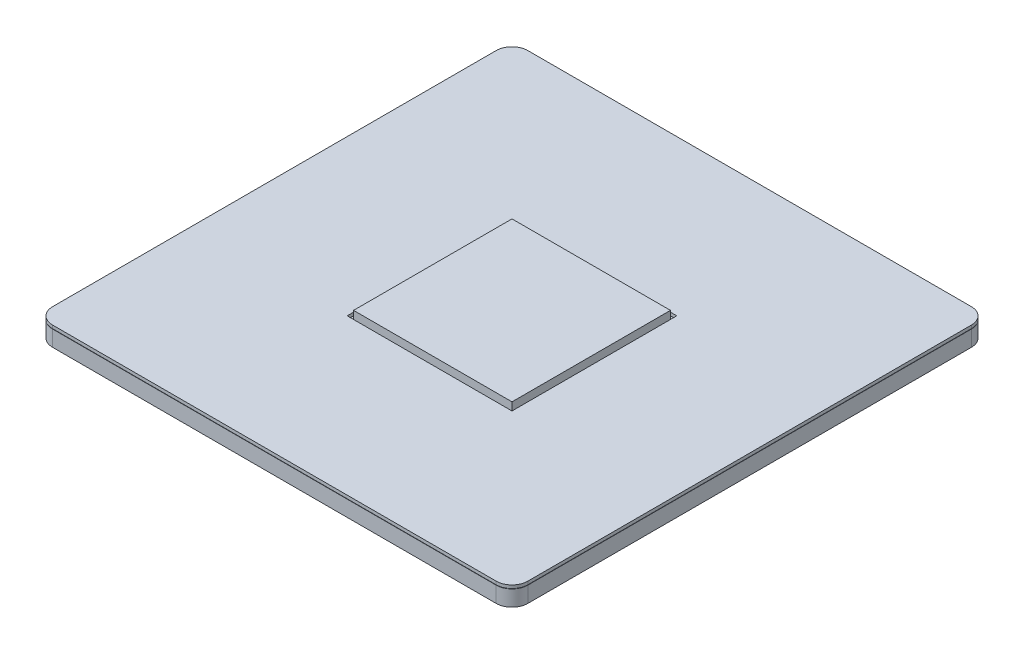
from build123d import *

# Parameters (mm, degrees)
SKETCH_1_W      = 15
SKETCH_1_H      = 15
EXTRUDE_1_DEPTH = 0.5
FILLET_1_R      = 0.5
EXTRUDE_START   = 0.1
SKETCH_2_W      = 5.2
SKETCH_2_H      = 5.2
EXTRUDE_2_DEPTH = 0.1
SKETCH_3_W      = 5
SKETCH_3_H      = 5
EXTRUDE_3_DEPTH = 0.25


with BuildPart() as part:
    # 草图1 → 凸台-拉伸1 (new body)
    with BuildSketch(Plane(origin=(0, 0, 0), x_dir=(1, 0, 0), z_dir=(0, 1, 0))):
        Rectangle(SKETCH_1_W, SKETCH_1_H)
    extrude(amount=EXTRUDE_1_DEPTH)

    # 圆角1
    fillet_1_edges = [part.edges().sort_by_distance(p)[0] for p in [
        (7.5, 0.25, 7.5),
        (-7.5, 0.25, 7.5),
        (-7.5, 0.25, -7.5),
        (7.5, 0.25, -7.5),
    ]]
    fillet(fillet_1_edges, radius=FILLET_1_R)


with BuildPart() as body_2:
    # 草图2 → 凸台-拉伸2 (new body)
    with BuildSketch(Plane(origin=(0, 0.51, 0), x_dir=(1, 0, 0), z_dir=(0, 1, 0)).offset(EXTRUDE_START)):
        with BuildLine():
            Line((-7.5, 7), (-7.5, -7))
            ThreePointArc((-7.5, -7), (-7.353553391, -7.353553391), (-7, -7.5))
            Line((-7, -7.5), (7, -7.5))
            ThreePointArc((7, -7.5), (7.353553391, -7.353553391), (7.5, -7))
            Line((7.5, -7), (7.5, 7))
            ThreePointArc((7.5, 7), (7.353553391, 7.353553391), (7, 7.5))
            Line((7, 7.5), (-7, 7.5))
            ThreePointArc((-7, 7.5), (-7.353553391, 7.353553391), (-7.5, 7))
        make_face()
        Rectangle(SKETCH_2_W, SKETCH_2_H, mode=Mode.SUBTRACT)
    extrude(amount=-EXTRUDE_2_DEPTH)


with BuildPart() as body_3:
    # 草图3 → 凸台-拉伸3 (new body)
    with BuildSketch(Plane(origin=(0, 0.51, 0), x_dir=(1, 0, 0), z_dir=(0, 1, 0))):
        Rectangle(SKETCH_3_W, SKETCH_3_H)
    extrude(amount=EXTRUDE_3_DEPTH)


solid = Compound([part.part, body_2.part, body_3.part])
